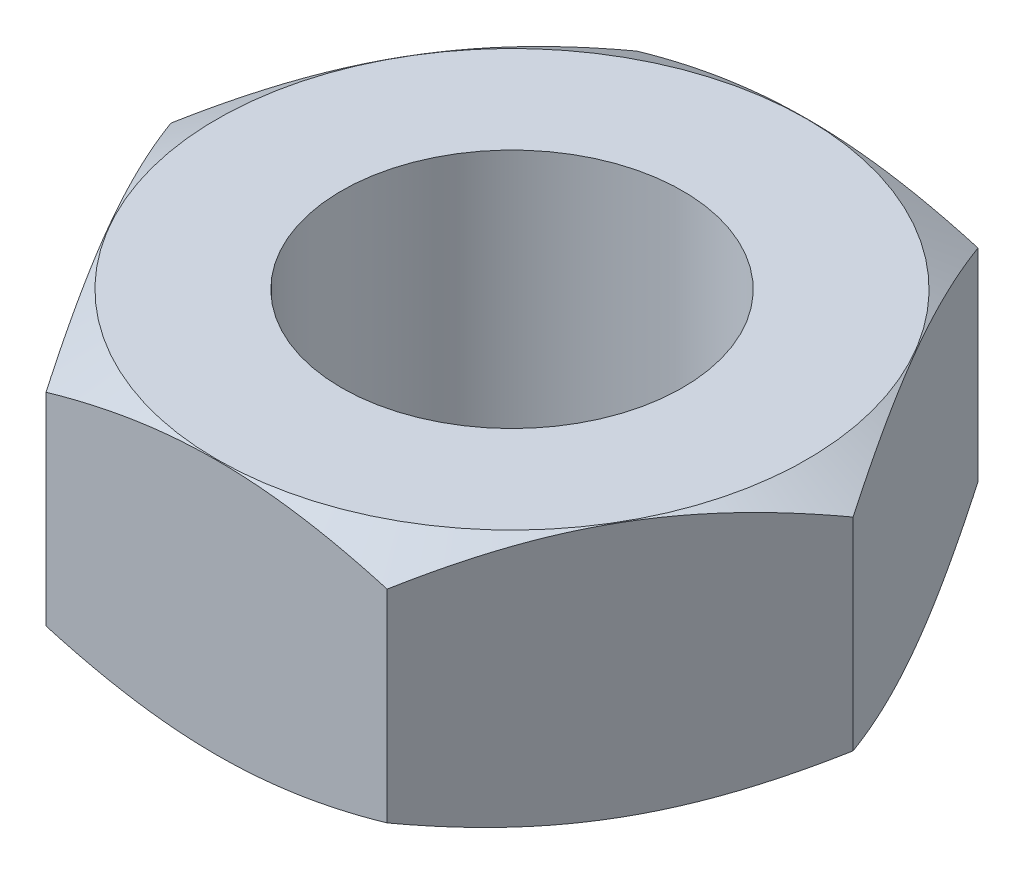
from build123d import *

# Parameters (mm, degrees)
SKETCH1_R               = 10
BOSS_EXTRUDE1_DEPTH     = 7.5
SKETCH2_OUTSIDE_W       = 161.82
SKETCH2_OUTSIDE_H       = 156.462
SKETCH2_OUTSIDE_R       = 17.291075739
CUT_EXTRUDE1_DEPTH      = 31.413812651
CUT_EXTRUDE1_DRAFT      = -60
MIRROR1_COPY_1_SKETCH_W = 161.82
MIRROR1_COPY_1_SKETCH_H = 156.462
MIRROR1_COPY_1_SKETCH_R = 17.291075739
MIRROR1_COPY_1_DEPTH    = 31.413812651
MIRROR1_COPY_1_DRAFT    = -60


with BuildPart() as part:
    # Sketch1 → Boss-Extrude1 (new, symmetric)
    with BuildSketch(Plane(origin=(0, 0, 0), x_dir=(1, 0, 0), z_dir=(0, 1, 0))):
        Polygon((10, -17.320508076), (20, 0), (10, 17.320508076), (-10, 17.320508076), (-20, 0), (-10, -17.320508076), align=None)
        with Locations(Location((0, 0, 0), (0, 0, 270))):
            Circle(SKETCH1_R, mode=Mode.SUBTRACT)
    extrude(amount=BOSS_EXTRUDE1_DEPTH, both=True)


with BuildPart() as cut_extrude1_tool:
    # Sketch2 outside → Cut-Extrude1 (with draft: the straight prism first)
    with BuildSketch(Plane(origin=(0, 7.5, 0), x_dir=(1, 0, 0), z_dir=(0, 1, 0))):
        Rectangle(SKETCH2_OUTSIDE_W, SKETCH2_OUTSIDE_H)
        Circle(SKETCH2_OUTSIDE_R, mode=Mode.SUBTRACT)
    extrude(amount=-CUT_EXTRUDE1_DEPTH)
    # Cut-Extrude1: the draft: its side faces are tilted about the plane it starts from
    cut_extrude1_sides = [cut_extrude1_tool.faces().sort_by_distance(p)[0] for p in [
        (0, -8.206906326, 78.231),
        (80.91, -8.206906326, 0),
        (0, -8.206906326, -78.231),
        (-80.91, -8.206906326, 0),
        (-17.291075739, -8.206906326, 0),
    ]]
    draft(cut_extrude1_sides, Plane(origin=(0, 7.5, 0), x_dir=(1, 0, 0), z_dir=(0, 1, 0)), CUT_EXTRUDE1_DRAFT)


with BuildPart() as part_1:
    add(part.part)

    # Cut-Extrude1: cut by cut_extrude1_tool
    add(cut_extrude1_tool.part, mode=Mode.SUBTRACT)


with BuildPart() as mirror1_copy_1_tool:
    # Mirror1 copy 1 sketch → Mirror1 copy 1 (with draft: the straight prism first)
    with BuildSketch(Plane.XZ.offset(7.5)):
        Rectangle(MIRROR1_COPY_1_SKETCH_W, MIRROR1_COPY_1_SKETCH_H)
        Circle(MIRROR1_COPY_1_SKETCH_R, mode=Mode.SUBTRACT)
    extrude(amount=-MIRROR1_COPY_1_DEPTH)
    # Mirror1 copy 1: the draft: its side faces are tilted about the plane it starts from
    mirror1_copy_1_sides = [mirror1_copy_1_tool.faces().sort_by_distance(p)[0] for p in [
        (0, 8.206906326, 78.231),
        (80.91, 8.206906326, 0),
        (0, 8.206906326, -78.231),
        (-80.91, 8.206906326, 0),
        (-17.291075739, 8.206906326, 0),
    ]]
    draft(mirror1_copy_1_sides, Plane.XZ.offset(7.5), MIRROR1_COPY_1_DRAFT)


with BuildPart() as part_2:
    add(part_1.part)

    # Mirror1 copy 1: cut by mirror1_copy_1_tool
    add(mirror1_copy_1_tool.part, mode=Mode.SUBTRACT)


solid = part_2.part
